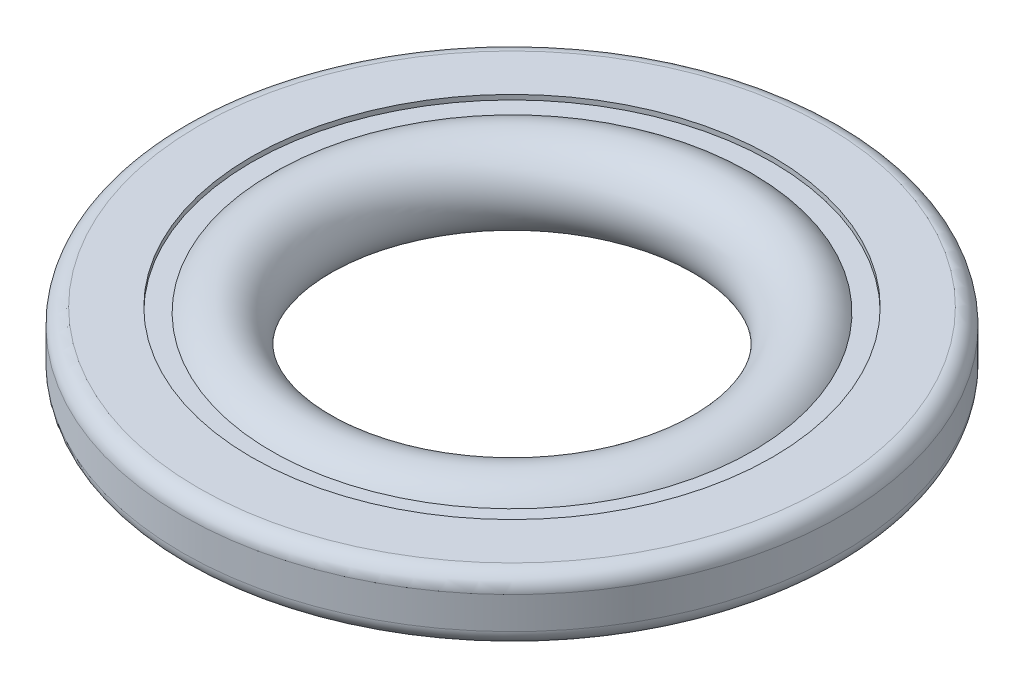
from build123d import *

# Parameters (mm, degrees)
FILLET1_R = 0.275


with BuildPart() as part:
    # Sketch2 → Revolve1 (revolve)
    with BuildSketch(Plane.XY, mode=Mode.PRIVATE) as revolve1_sk:
        Polygon((-5.65, 0.55), (-4.463953488, 0.55), (-4.463953488, 0.4675), (-4.627906977, 0.4675), (-4.627906977, -0.4675), (-4.463953488, -0.4675), (-4.463953488, -0.55), (-5.65, -0.55), align=None)
    revolve(revolve1_sk.sketch.rotate(Axis((0, 0, 0), (0, 1, 0)), 270), axis=Axis((0, 0, 0), (0, 1, 0)))

    # Fillet1
    fillet1_edges = [part.edges().sort_by_distance(p)[0] for p in [
        (0, 0.55, 5.65),
        (0, -0.55, 5.65),
    ]]
    fillet(fillet1_edges, radius=FILLET1_R)


with BuildPart() as body_2:
    # Sketch4 → Revolve2 (revolve)
    with BuildSketch(Plane.XY, mode=Mode.PRIVATE) as revolve2_sk:
        with BuildLine():
            Line((-4.627906977, 0.4675), (-4.627906977, -0.4675))
            Line((-4.627906977, -0.4675), (-4.121002639, -0.4675))
            ThreePointArc((-4.121002639, -0.4675), (-2.9, 0), (-4.121002639, 0.4675))
            Line((-4.121002639, 0.4675), (-4.627906977, 0.4675))
        make_face()
    revolve(revolve2_sk.sketch.rotate(Axis((0, 0, 0), (0, 1, 0)), 270), axis=Axis((0, 0, 0), (0, 1, 0)))


solid = Compound([part.part, body_2.part])
